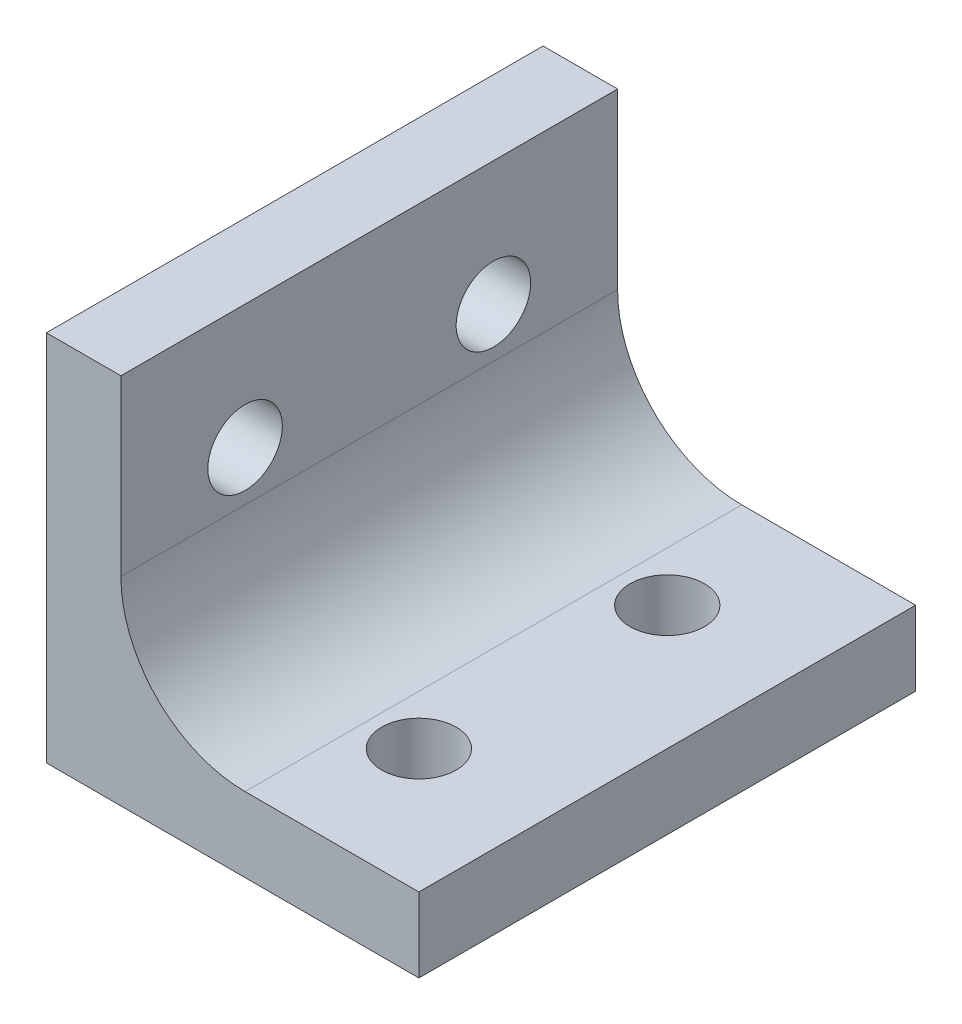
from build123d import *

# Parameters (mm, degrees)
SKETCH_1_W            = 15
SKETCH_1_H            = 20
EXTRUDE_1_DEPTH       = 15
SKETCH_2_W            = 12
SKETCH_2_H            = 12
CUT_EXTRUDE_1_DEPTH   = 30.154759474
HOLE_WIZARD_3_0_3_1_D = 3
HOLE_WIZARD_3_0_3_2_D = 3
FILLET_1_R            = 5


with BuildPart() as part:
    # 草图1 → 凸台-拉伸1 (new body)
    with BuildSketch(Plane(origin=(0, 0, 0), x_dir=(1, 0, 0), z_dir=(0, 1, 0))):
        with Locations((7.5, -10)):
            Rectangle(SKETCH_1_W, SKETCH_1_H)
    extrude(amount=-EXTRUDE_1_DEPTH)

    # 草图2 → 切除-拉伸1 (cut, through all)
    with BuildSketch(Plane(origin=(0, 0, 0), x_dir=(-1, 0, 0), z_dir=(0, 0, -1))):
        with Locations((-9, -6)):
            Rectangle(SKETCH_2_W, SKETCH_2_H)
    extrude(amount=-CUT_EXTRUDE_1_DEPTH, mode=Mode.SUBTRACT)

    # Ø3.0 (3) 直径孔1 (through all)
    with Locations(Plane(origin=(3, 0, 0), x_dir=(0, 0, -1), z_dir=(1, 0, 0))):
        with Locations((-5, -5), (-15, -5)):
            Hole(HOLE_WIZARD_3_0_3_1_D / 2)

    # Ø3.0 (3) 直径孔2 (through all)
    with Locations(Plane(origin=(0, -12, 0), x_dir=(1, 0, 0), z_dir=(0, 1, 0))):
        with Locations((10, -5), (10, -15)):
            Hole(HOLE_WIZARD_3_0_3_2_D / 2)

    # 圆角1
    fillet_1_edges = [part.edges().sort_by_distance(p)[0] for p in [
        (3, -12, 10),
    ]]
    fillet(fillet_1_edges, radius=FILLET_1_R)


solid = part.part
